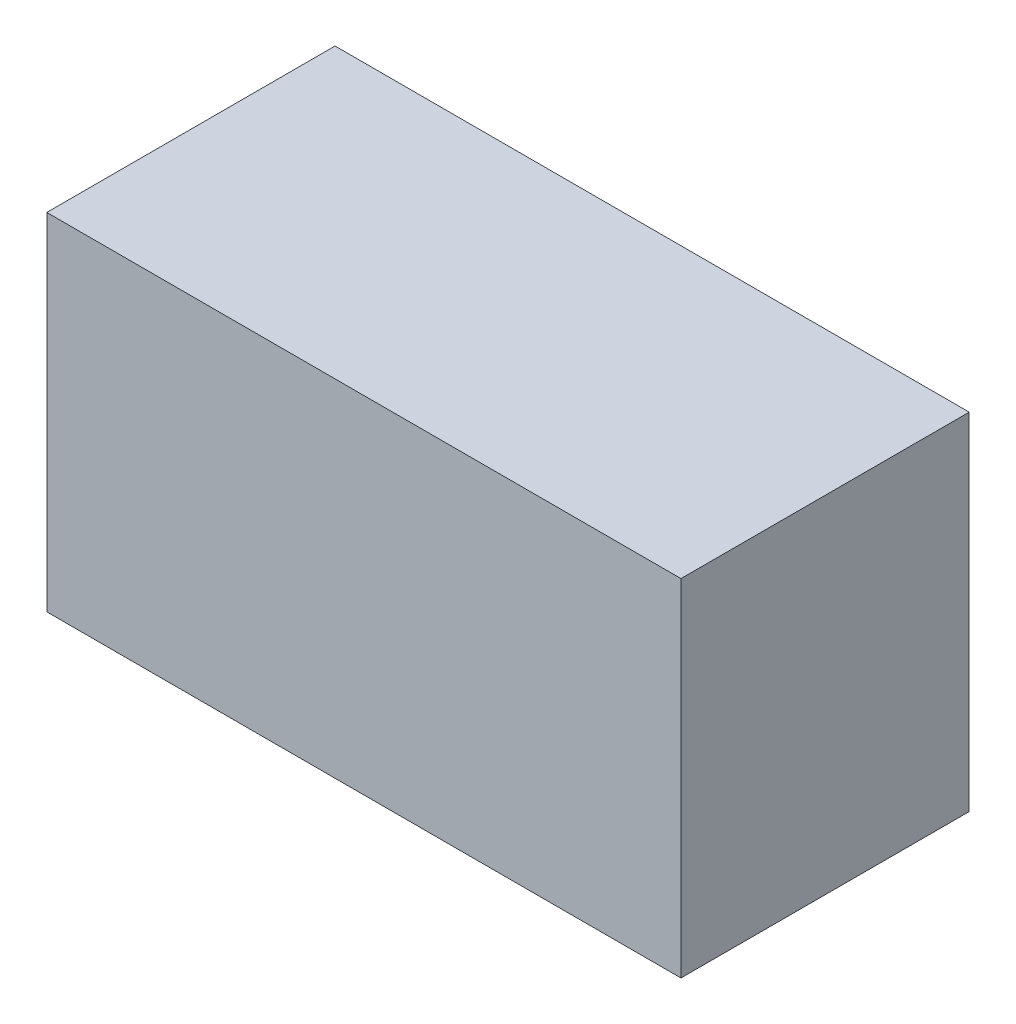
from build123d import *

# Parameters (mm, degrees)
SKETCH_1_W      = 11
SKETCH_1_H      = 6
EXTRUDE_1_DEPTH = 5


with BuildPart() as part:
    # Эскиз1 → Бобышка-Вытянуть1 (new body)
    with BuildSketch(Plane.XY):
        Rectangle(SKETCH_1_W, SKETCH_1_H)
    extrude(amount=EXTRUDE_1_DEPTH)


solid = part.part
